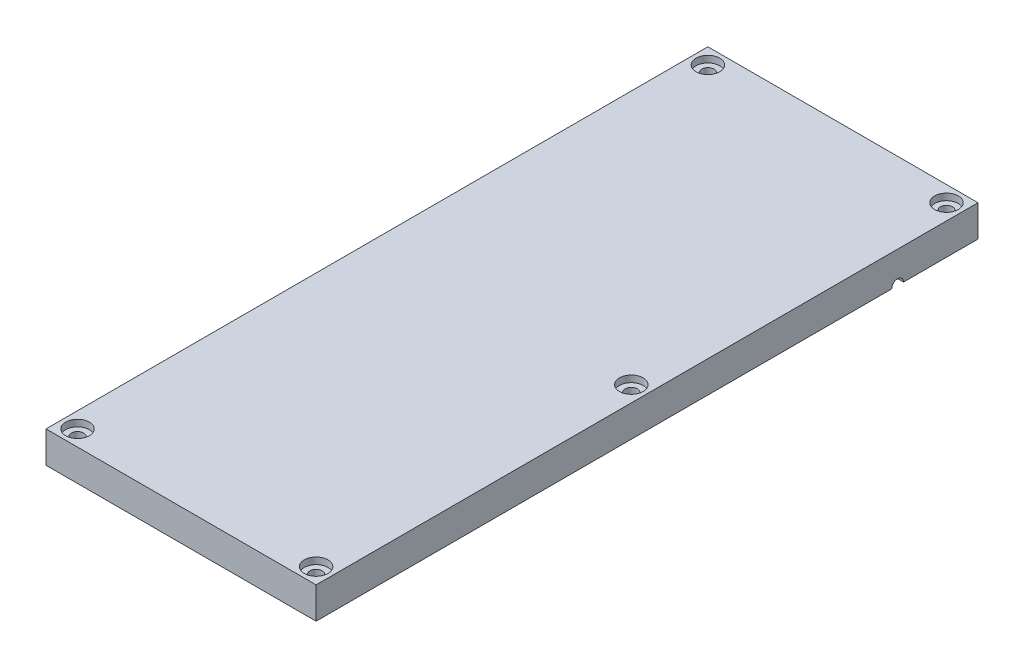
from build123d import *

# Parameters (mm, degrees)
BOSS_EXTRUDE1_START                                 = 12.7
SKETCH1_W                                           = 108.839
SKETCH1_H                                           = 266.7
BOSS_EXTRUDE1_DEPTH                                 = 12.7
CBORE_FOR_8_BINDING_HEAD_MACHINE_SCREW1_D           = 4.9149
CBORE_FOR_8_BINDING_HEAD_MACHINE_SCREW1_CBORE_D     = 9.525
CBORE_FOR_8_BINDING_HEAD_MACHINE_SCREW1_CBORE_DEPTH = 2.667
SKETCH4_W                                           = 71.374
SKETCH4_H                                           = 223.52
CUT_EXTRUDE1_DEPTH                                  = 9.525
SKETCH6_R                                           = 2.38125
SKETCH8_W                                           = 12.7
SKETCH8_H                                           = 12.7
CUT_EXTRUDE3_DEPTH                                  = 9.525


with BuildPart() as part:
    # Sketch1 → Boss-Extrude1 (new body)
    with BuildSketch(Plane(origin=(0, 0, 0), x_dir=(1, 0, 0), z_dir=(0, 1, 0)).offset(BOSS_EXTRUDE1_START)):
        with Locations((91.6305, 133.35)):
            Rectangle(SKETCH1_W, SKETCH1_H)
    extrude(amount=BOSS_EXTRUDE1_DEPTH)

    # CBORE for #8 Binding Head Machine Screw1 (through all)
    with Locations(Plane(origin=(0, 25.4, 0), x_dir=(1, 0, 0), z_dir=(0, 1, 0))):
        with Locations((139.7, 6.35), (139.7, 260.35), (43.561, 6.35), (43.561, 260.35), (139.7, 133.35)):
            CounterBoreHole(CBORE_FOR_8_BINDING_HEAD_MACHINE_SCREW1_D / 2, CBORE_FOR_8_BINDING_HEAD_MACHINE_SCREW1_CBORE_D / 2, CBORE_FOR_8_BINDING_HEAD_MACHINE_SCREW1_CBORE_DEPTH)

    # Sketch4 → Cut-Extrude1 (cut)
    with BuildSketch(Plane(origin=(0, 12.7, 0), x_dir=(-1, 0, 0), z_dir=(0, -1, 0))):
        with Locations((-79.248, 130.175)):
            Rectangle(SKETCH4_W, SKETCH4_H)
    extrude(amount=-CUT_EXTRUDE1_DEPTH, mode=Mode.SUBTRACT)

    # Cut-Sweep1: sweep along a path in Sketch5
    with BuildLine(Plane.XZ.offset(-12.7)) as cut_sweep1_path:
        Line((114.935, -196.215), (120.015, -196.215))
        Line((120.015, -196.215), (120.015, -234.315))
        Line((120.015, -234.315), (128.905, -234.315))
        Line((128.905, -234.315), (128.905, -158.115))
        Line((128.905, -158.115), (137.795, -158.115))
        Line((137.795, -158.115), (137.795, -234.315))
        Line((137.795, -234.315), (146.05, -234.315))
    # Sketch6 → Cut-Sweep1 (sweep, cut)
    with BuildSketch(Plane(origin=(146.05, 0, 0), x_dir=(0, 0, -1), z_dir=(1, 0, 0))):
        with Locations((234.315, 12.7)):
            Circle(SKETCH6_R)
    sweep(path=cut_sweep1_path.line, transition=Transition.RIGHT, mode=Mode.SUBTRACT)

    # Sketch8 → Cut-Extrude3 (cut)
    with BuildSketch(Plane.XZ.offset(-12.7)):
        with Locations((121.285, -62.865)):
            Rectangle(SKETCH8_W, SKETCH8_H)
        with Locations((89.535, -248.285)):
            Rectangle(SKETCH8_W, SKETCH8_H)
    extrude(amount=-CUT_EXTRUDE3_DEPTH, mode=Mode.SUBTRACT)


solid = part.part
